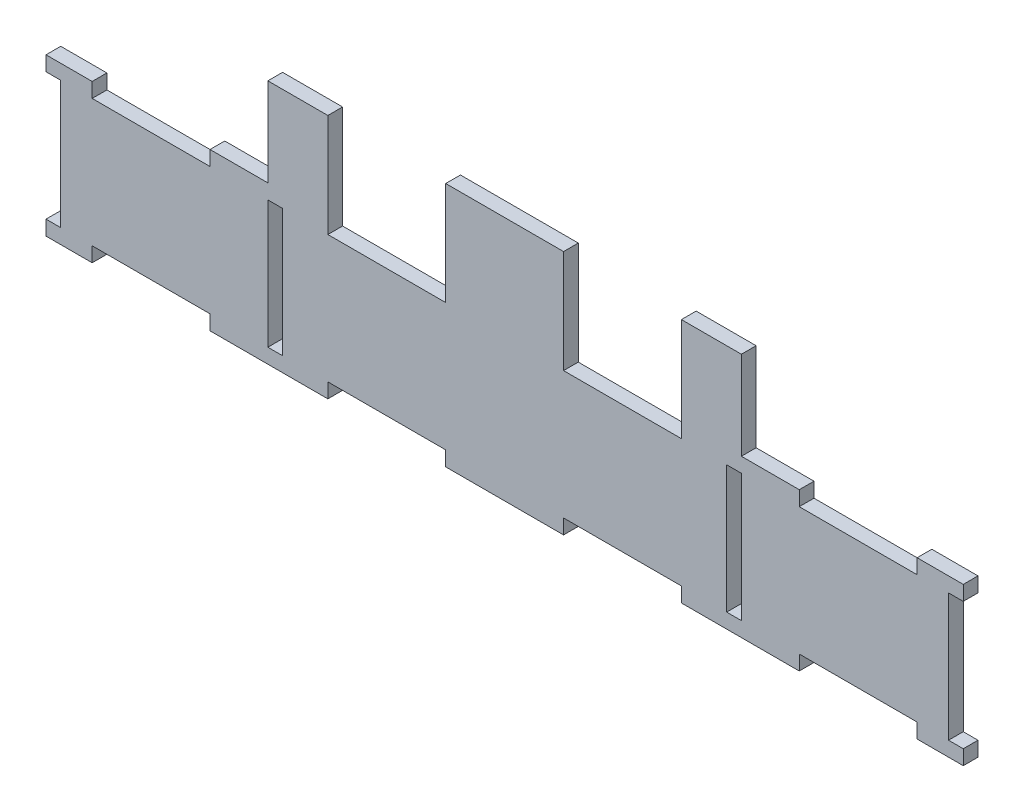
from build123d import *

# Parameters (mm, degrees)
SKETCH1_W           = 395.4
SKETCH1_H           = 67.700000012
BOSS_EXTRUDE1_DEPTH = 6.35
SKETCH2_W           = 50.8
SKETCH2_H           = 6.35
SKETCH2_W_2         = 6.35
SKETCH2_H_2         = 55.000000012
CUT_EXTRUDE1_DEPTH  = 201.677440188
SKETCH5_W           = 6.35
SKETCH5_H           = 55.000000012
CUT_EXTRUDE2_DEPTH  = 201.677440188
SKETCH6_W           = 25.8625
SKETCH6_H           = 6.35
SKETCH6_W_2         = 50.8
BOSS_EXTRUDE2_DEPTH = 38.1


with BuildPart() as part:
    # Sketch1 → Boss-Extrude1 (new body)
    with BuildSketch(Plane.XY):
        Rectangle(SKETCH1_W, SKETCH1_H)
    extrude(amount=BOSS_EXTRUDE1_DEPTH)

    # Sketch2 → Cut-Extrude1 (cut, through all)
    with BuildSketch(Plane.XY.offset(6.35)):
        with Locations((152.4, -30.675000006)):
            Rectangle(SKETCH2_W, SKETCH2_H)
        with Locations((152.4, 30.675000006)):
            Rectangle(SKETCH2_W, SKETCH2_H)
        with Locations((98.8875, 0)):
            Rectangle(SKETCH2_W_2, SKETCH2_H_2)
        with Locations((50.8, -30.675000006)):
            Rectangle(SKETCH2_W, SKETCH2_H)
        with Locations((50.8, 30.675000006)):
            Rectangle(SKETCH2_W, SKETCH2_H)
        with Locations((-50.8, -30.675000006)):
            Rectangle(SKETCH2_W, SKETCH2_H)
        with Locations((-50.8, 30.675000006)):
            Rectangle(SKETCH2_W, SKETCH2_H)
        with Locations((-152.4, -30.675000006)):
            Rectangle(SKETCH2_W, SKETCH2_H)
        with Locations((-152.4, 30.675000006)):
            Rectangle(SKETCH2_W, SKETCH2_H)
        with Locations((-98.8875, 0)):
            Rectangle(SKETCH2_W_2, SKETCH2_H_2)
    extrude(amount=-CUT_EXTRUDE1_DEPTH, mode=Mode.SUBTRACT)

    # Sketch5 → Cut-Extrude2 (cut, through all)
    with BuildSketch(Plane.XY.offset(6.35)):
        with Locations((-194.525, 0)):
            Rectangle(SKETCH5_W, SKETCH5_H)
        with Locations((194.525, 0)):
            Rectangle(SKETCH5_W, SKETCH5_H)
    extrude(amount=-CUT_EXTRUDE2_DEPTH, mode=Mode.SUBTRACT)

    # Sketch6 → Boss-Extrude2 (add)
    with BuildSketch(Plane(origin=(0, 33.850000006, 0), x_dir=(1, 0, 0), z_dir=(0, 1, 0))):
        with Locations((89.13125, -3.175)):
            Rectangle(SKETCH6_W, SKETCH6_H)
        with Locations((0, -3.175)):
            Rectangle(SKETCH6_W_2, SKETCH6_H)
        with Locations((-89.13125, -3.175)):
            Rectangle(SKETCH6_W, SKETCH6_H)
    extrude(amount=BOSS_EXTRUDE2_DEPTH)


solid = part.part
